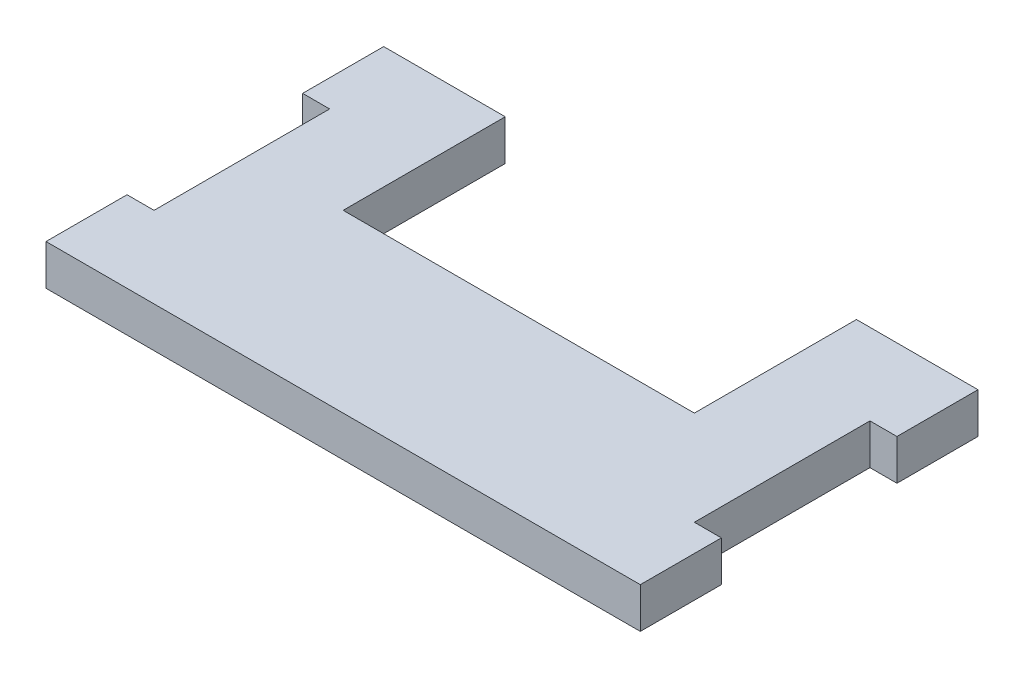
from build123d import *

# Parameters (mm, degrees)
SKETCH1_W           = 2
SKETCH1_H           = 6
BOSS_EXTRUDE1_DEPTH = 3


with BuildPart() as part:
    # Sketch1 → Boss-Extrude1 (new body)
    with BuildSketch(Plane(origin=(0, 0, 0), x_dir=(1, 0, 0), z_dir=(0, 1, 0))):
        Polygon((0, 6), (0, 0), (40, 0), (40, 6), (40, 19), (40, 25), (33, 25), (33, 13), (20, 13), (7, 13), (7, 25), (0, 25), (0, 19), align=None)
        with Locations((-1, 22)):
            Rectangle(SKETCH1_W, SKETCH1_H)
        with Locations((-1, 3)):
            Rectangle(SKETCH1_W, SKETCH1_H)
        with Locations((41, 3)):
            Rectangle(SKETCH1_W, SKETCH1_H)
        with Locations((41, 22)):
            Rectangle(SKETCH1_W, SKETCH1_H)
    extrude(amount=BOSS_EXTRUDE1_DEPTH)


solid = part.part
